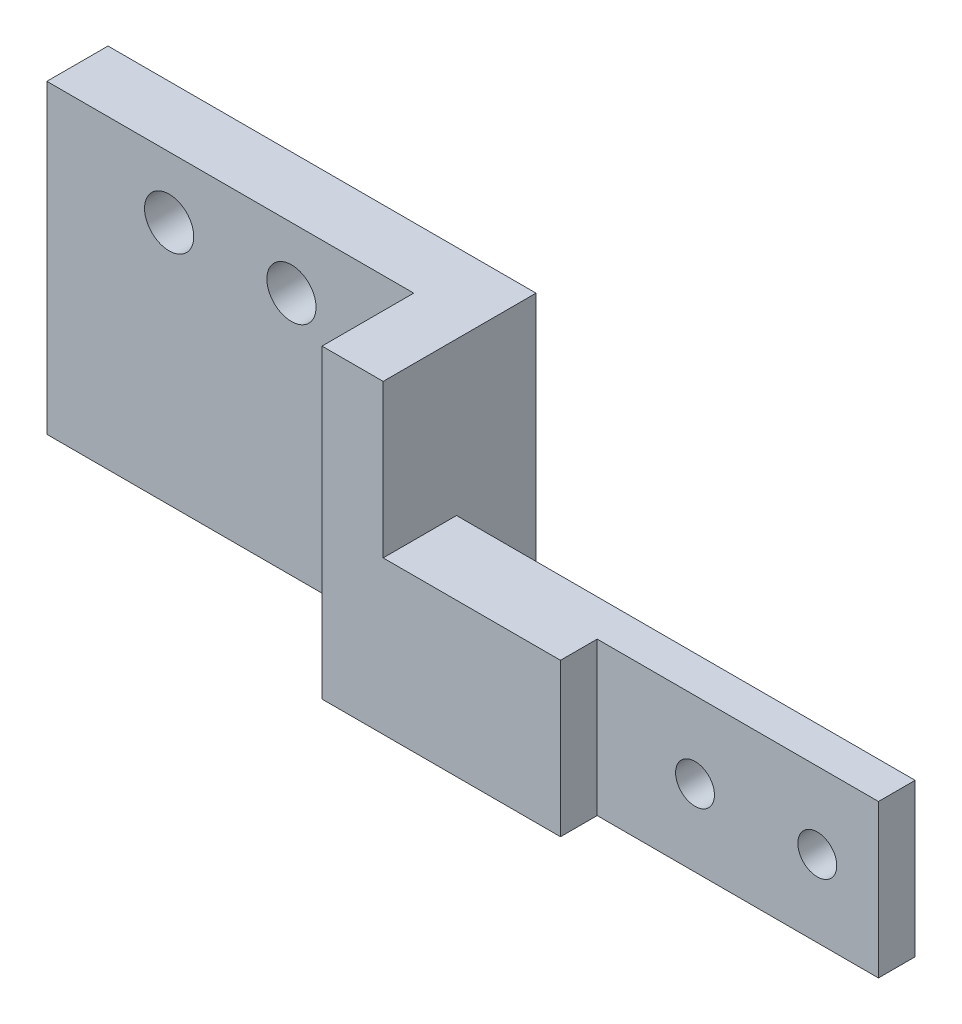
from build123d import *

# Parameters (mm, degrees)
SKETCH1_W                    = 92.075
SKETCH1_H                    = 15.875
BOSS_EXTRUDE1_DEPTH          = 15.875
CUT_EXTRUDE1_REACH           = 53.22
SKETCH2_W                    = 47.625
SKETCH2_H                    = 15.875
F_10_0_1935_DIAMETER_HOLE1_D = 5.1054
CUT_EXTRUDE2_REACH           = 51.34
SKETCH5_W                    = 47.625
SKETCH5_H                    = 8.255
CUT_EXTRUDE3_REACH           = 51.34
SKETCH6_W                    = 47.625
SKETCH6_H                    = 3.81
SKETCH7_W                    = 38.1
SKETCH7_H                    = 9.525
CUT_EXTRUDE4_DEPTH           = 57.484668827
SKETCH8_W                    = 6.35
SKETCH8_H                    = 3.81
CUT_EXTRUDE5_DEPTH           = 57.484668827
F_10_32_TAPPED_HOLE1_D       = 4.0386
SKETCH11_W                   = 24.765
SKETCH11_H                   = 15.875
BOSS_EXTRUDE2_DEPTH          = 3.81
SKETCH12_W                   = 6.35
SKETCH12_H                   = 15.875
BOSS_EXTRUDE3_DEPTH          = 3.81


with BuildPart() as part:
    # Sketch1 → Boss-Extrude1 (new, symmetric)
    with BuildSketch(Plane(origin=(0, 0, 0), x_dir=(1, 0, 0), z_dir=(0, 1, 0))):
        Rectangle(SKETCH1_W, SKETCH1_H)
    extrude(amount=BOSS_EXTRUDE1_DEPTH, both=True)

    # Sketch2 → Cut-Extrude1 (cut, up to next)
    with BuildSketch(Plane.XY.offset(7.9375), mode=Mode.PRIVATE) as cut_extrude1_sk1:
        with Locations((22.225, 7.9375)):
            Rectangle(SKETCH2_W, SKETCH2_H)
    cut_extrude1_tool1 = extrude(cut_extrude1_sk1.sketch, amount=-CUT_EXTRUDE1_REACH, mode=Mode.PRIVATE) & part.part
    add(cut_extrude1_tool1.solids().sort_by_distance((22.225, 7.9375, 7.9375))[0], mode=Mode.SUBTRACT)

    # #10 (0.1935) Diameter Hole1 (through all)
    with Locations(Plane.XY.offset(7.9375)):
        with Locations((-33.3375, 9.525), (-20.6375, 9.525)):
            Hole(F_10_0_1935_DIAMETER_HOLE1_D / 2)

    # Sketch5 → Cut-Extrude2 (cut, up to next)
    with BuildSketch(Plane(origin=(0, 0, 0), x_dir=(1, 0, 0), z_dir=(0, 1, 0)), mode=Mode.PRIVATE) as cut_extrude2_sk1:
        with Locations((22.225, 3.81)):
            Rectangle(SKETCH5_W, SKETCH5_H)
    cut_extrude2_tool1 = extrude(cut_extrude2_sk1.sketch, amount=-CUT_EXTRUDE2_REACH, mode=Mode.PRIVATE) & part.part
    add(cut_extrude2_tool1.solids().sort_by_distance((22.225, 0, -3.81))[0], mode=Mode.SUBTRACT)

    # Sketch6 → Cut-Extrude3 (cut, up to next)
    with BuildSketch(Plane(origin=(0, 0, 0), x_dir=(1, 0, 0), z_dir=(0, 1, 0)), mode=Mode.PRIVATE) as cut_extrude3_sk1:
        with Locations((22.225, -6.0325)):
            Rectangle(SKETCH6_W, SKETCH6_H)
    cut_extrude3_tool1 = extrude(cut_extrude3_sk1.sketch, amount=-CUT_EXTRUDE3_REACH, mode=Mode.PRIVATE) & part.part
    add(cut_extrude3_tool1.solids().sort_by_distance((22.225, 0, 6.0325))[0], mode=Mode.SUBTRACT)

    # Sketch7 → Cut-Extrude4 (cut, through all)
    with BuildSketch(Plane(origin=(0, 15.875, 0), x_dir=(1, 0, 0), z_dir=(0, 1, 0))):
        with Locations((-26.9875, -3.175)):
            Rectangle(SKETCH7_W, SKETCH7_H)
    extrude(amount=-CUT_EXTRUDE4_DEPTH, mode=Mode.SUBTRACT)

    # Sketch8 → Cut-Extrude5 (cut, through all)
    with BuildSketch(Plane(origin=(0, 15.875, 0), x_dir=(1, 0, 0), z_dir=(0, 1, 0))):
        with Locations((-4.7625, -6.0325)):
            Rectangle(SKETCH8_W, SKETCH8_H)
    extrude(amount=-CUT_EXTRUDE5_DEPTH, mode=Mode.SUBTRACT)

    # #10-32 Tapped Hole1 (through all)
    with Locations(Plane.XY.offset(4.1275)):
        with Locations((39.6875, -7.9375), (26.9875, -7.9375)):
            Hole(F_10_32_TAPPED_HOLE1_D / 2)

    # Sketch11 → Boss-Extrude2 (add)
    with BuildSketch(Plane.XY.offset(4.1275)):
        with Locations((4.445, -7.9375)):
            Rectangle(SKETCH11_W, SKETCH11_H)
    extrude(amount=BOSS_EXTRUDE2_DEPTH)

    # Sketch12 → Boss-Extrude3 (add)
    with BuildSketch(Plane.XY.offset(4.1275)):
        with Locations((-4.7625, 7.9375)):
            Rectangle(SKETCH12_W, SKETCH12_H)
    extrude(amount=BOSS_EXTRUDE3_DEPTH)


solid = part.part
